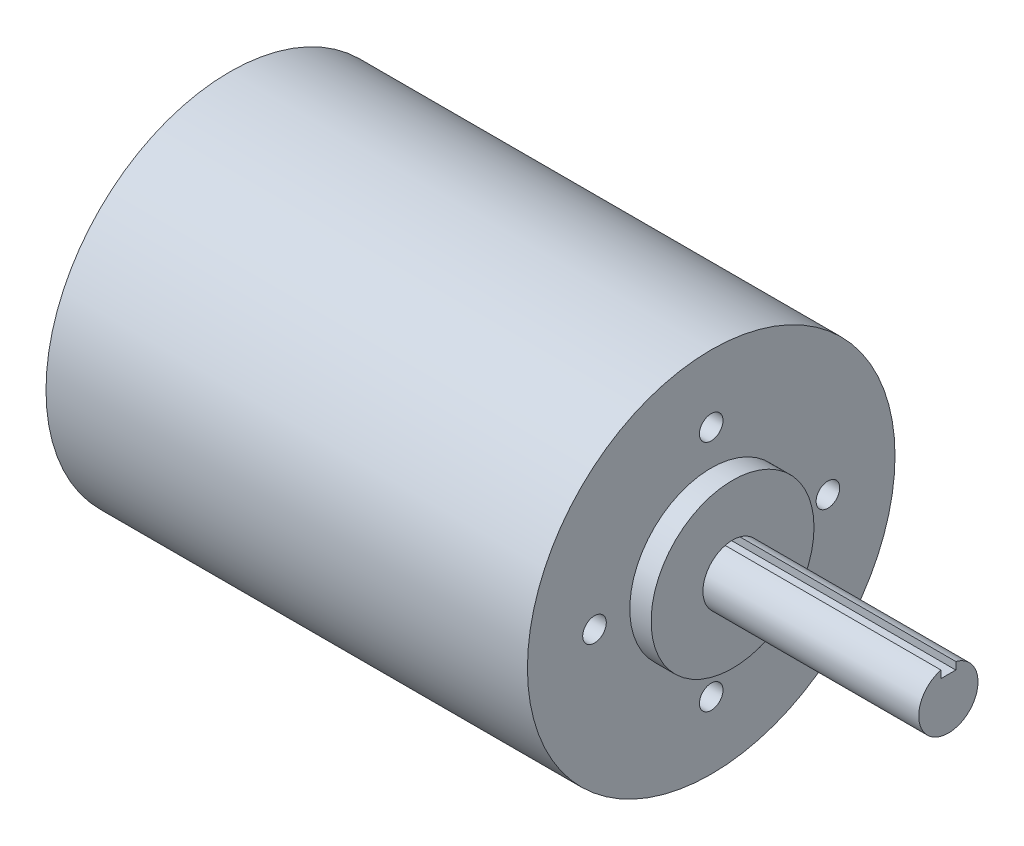
from build123d import *

# Parameters (mm, degrees)
SKETCH1_R           = 39.37
BOSS_EXTRUDE1_DEPTH = 103.124
BOSS_EXTRUDE2_DEPTH = 50.8
CIRPATTERN1_COUNT   = 4
SKETCH6_R           = 17.4498
SKETCH6_R_2         = 6.35
BOSS_EXTRUDE3_DEPTH = 4.572


with BuildPart() as part:
    # Sketch1 → Boss-Extrude1 (new body)
    with BuildSketch(Plane(origin=(0, 0, 0), x_dir=(0, 0, -1), z_dir=(1, 0, 0))):
        Circle(SKETCH1_R)
    extrude(amount=BOSS_EXTRUDE1_DEPTH)

    # Sketch2 → Boss-Extrude2 (add)
    with BuildSketch(Plane(origin=(103.124, 0, 0), x_dir=(0, 0, -1), z_dir=(1, 0, 0))):
        with BuildLine():
            Line((-1.5875, 6.148361062), (-1.5875, 4.560861062))
            Line((-1.5875, 4.560861062), (1.5875, 4.560861062))
            Line((1.5875, 4.560861062), (1.5875, 6.148361062))
            ThreePointArc((1.5875, 6.148361062), (0, -6.35), (-1.5875, 6.148361062))
        make_face()
    extrude(amount=BOSS_EXTRUDE2_DEPTH)

    # Sketch4 → #8 (0.199) Diameter Hole1 (revolve, cut)
    with BuildSketch(Plane(origin=(103.124, 25, 0), x_dir=(0, 0, -1), z_dir=(0, 1, 0))):
        Polygon((0, 0), (0, 11.518555042), (2.5273, 10), (2.5273, 0), align=None)
    f_8_0_199_diameter_hole1 = revolve(axis=Axis((109.474, 25, 0), (-1, 0, 0)), mode=Mode.SUBTRACT)

    # CirPattern1: #8 (0.199) Diameter Hole1 ×4 about axis
    cirpattern1_axis = Axis((0, 0, 0), (1, 0, 0))
    for i in range(1, CIRPATTERN1_COUNT):
        add(f_8_0_199_diameter_hole1.rotate(cirpattern1_axis, i * 360 / CIRPATTERN1_COUNT), mode=Mode.SUBTRACT)

    # Sketch6 → Boss-Extrude3 (add)
    with BuildSketch(Plane(origin=(103.124, 0, 0), x_dir=(0, 0, -1), z_dir=(1, 0, 0))):
        Circle(SKETCH6_R)
        Circle(SKETCH6_R_2, mode=Mode.SUBTRACT)
    extrude(amount=BOSS_EXTRUDE3_DEPTH)


solid = part.part
